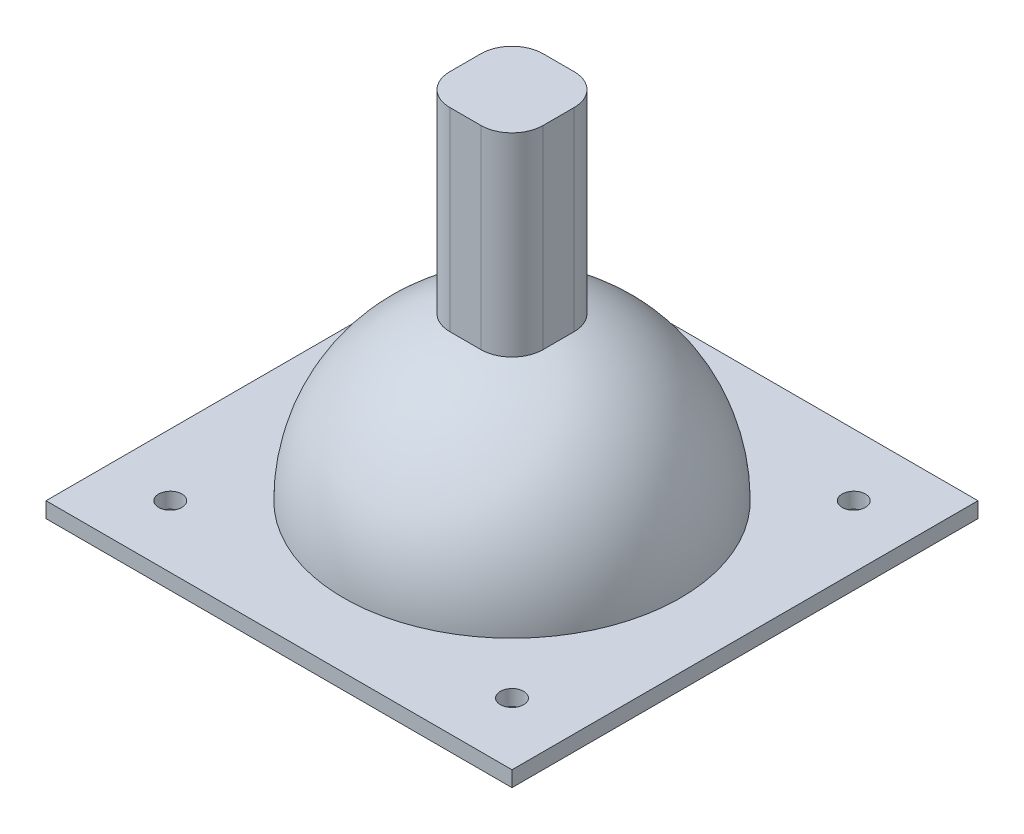
from build123d import *

# Parameters (mm, degrees)
BOSS_EXTRUDE1_DEPTH  = 31.75
FILLET1_R            = 5.08
BOSS_EXTRUDE2_DEPTH  = 2.5399999999999996
SKETCH5_R            = 24.891999999999996
CUT_EXTRUDE1_DEPTH   = 2.54
SKETCH6_R            = 1.905
CUT_EXTRUDE2_DEPTH   = 80.32849774232189
LPATTERN1_COUNT      = 2
LPATTERN1_PITCH      = 55.88
LPATTERN1_COUNT_DIR2 = 2
LPATTERN1_PITCH_DIR2 = 55.88


with BuildPart() as part:
    # Sketch1 → Boss-Extrude1 (new body)
    with BuildSketch(Plane(origin=(0, 0, 0), x_dir=(1, 0, 0), z_dir=(0, 1, 0))):
        Polygon((7.620000000000001, -7.619999999999999), (-7.619999999999997, -7.620000000000001), (-7.619999999999997, 7.619999999999997), (7.62, 7.619999999999999), align=None)
    extrude(amount=BOSS_EXTRUDE1_DEPTH)

    # Fillet1
    fillet1_edges = [part.edges().sort_by_distance(p)[0] for p in [
        (-7.619999999999997, 15.875, -7.619999999999997),
        (7.62, 15.875, -7.619999999999999),
        (7.620000000000001, 15.875, 7.619999999999999),
        (-7.619999999999997, 15.875, 7.620000000000001),
    ]]
    fillet(fillet1_edges, radius=FILLET1_R)

    # Sketch3 → Revolve1 (revolve)
    with BuildSketch(Plane(origin=(0, 0, 0), x_dir=(0, 0, -1), z_dir=(1, 0, 0)), mode=Mode.PRIVATE) as revolve1_sk:
        with BuildLine():
            Line((25.00680208994189, -26.471907853088844), (27.546802089941888, -26.471907853088844))
            ThreePointArc((27.546802089941888, -26.471907853088844), (19.47853055780167, -6.993377295287178), (0, 1.0748942368530439))
            Line((0, 1.0748942368530439), (0, -1.4651057631469566))
            ThreePointArc((0, -1.4651057631469566), (17.68247933358784, -8.789428519501008), (25.00680208994189, -26.471907853088844))
        make_face()
    revolve(revolve1_sk.sketch.rotate(Axis((0, -1.26539568401347, 0), (0, -1, 0)), 180), axis=Axis((0, -1.26539568401347, 0), (0, -1, 0)))

    # Sketch4 → Boss-Extrude2 (add)
    with BuildSketch(Plane.XZ.offset(26.471907853088844)):
        Polygon((38.10000000000001, -38.099999999999994), (-38.099999999999994, -38.10000000000001), (-38.099999999999994, 38.099999999999994), (38.10000000000001, 38.10000000000001), align=None)
    extrude(amount=BOSS_EXTRUDE2_DEPTH)

    # Sketch5 → Cut-Extrude1 (cut)
    with BuildSketch(Plane.XZ.offset(29.011907853088847)):
        with Locations(Location((0, 0, 0), (0, 0, 270))):
            Circle(SKETCH5_R)
    extrude(amount=-CUT_EXTRUDE1_DEPTH, mode=Mode.SUBTRACT)

    # Sketch6 → Cut-Extrude2 (cut, through all)
    with BuildSketch(Plane(origin=(0, -26.471907853088844, 0), x_dir=(1, 0, 0), z_dir=(0, 1, 0))):
        with Locations(Location((-27.939999999999998, 27.94000000000001, 0), (0, 0, 270))):
            Circle(SKETCH6_R)
    cut_extrude2 = extrude(amount=-CUT_EXTRUDE2_DEPTH, mode=Mode.SUBTRACT)

    # LPattern1: Cut-Extrude2 2 × 2
    with Locations(*[(i * LPATTERN1_PITCH, 0, j * LPATTERN1_PITCH_DIR2) for i in range(LPATTERN1_COUNT) for j in range(LPATTERN1_COUNT_DIR2) if (i, j) != (0, 0)]):
        add(cut_extrude2, mode=Mode.SUBTRACT)


solid = part.part
